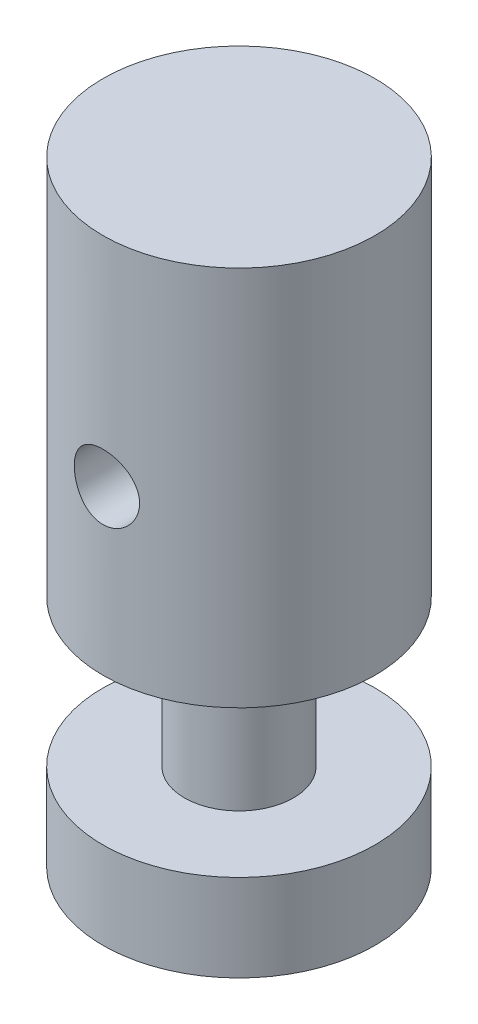
from build123d import *

# Parameters (mm, degrees)
SKETCH1_R               = 2.5
BOSS_EXTRUDE1_DEPTH     = 7
CUT_EXTRUDE1_DEPTH      = 8.842193571
CUT_EXTRUDE1_DEPTH_BACK = 8.842193571
SKETCH2_R               = 0.6
SKETCH3_R               = 1.002734692
BOSS_EXTRUDE2_DEPTH     = 4.3
SKETCH4_R               = 2.5
BOSS_EXTRUDE3_DEPTH     = 1.6


with BuildPart() as part:
    # Sketch1 → Boss-Extrude1 (new body)
    with BuildSketch(Plane(origin=(0, 0, 0), x_dir=(1, 0, 0), z_dir=(0, 1, 0))):
        with Locations(Location((0, 0, 0), (0, 0, 270))):
            Circle(SKETCH1_R)
    extrude(amount=BOSS_EXTRUDE1_DEPTH)

    # Sketch2 → Cut-Extrude1 (cut, two sides: drawn at the far end of the back side and taken through both)
    with BuildSketch(Plane.XY.offset(-CUT_EXTRUDE1_DEPTH_BACK)):
        with Locations(Location((0, 3, 0), (0, 0, 90.000000021))):
            Circle(SKETCH2_R)
    extrude(amount=CUT_EXTRUDE1_DEPTH + CUT_EXTRUDE1_DEPTH_BACK, mode=Mode.SUBTRACT)

    # Sketch3 → Boss-Extrude2 (add)
    with BuildSketch(Plane.XZ):
        with Locations(Location((0, 0, 0), (0, 0, 90))):
            Circle(SKETCH3_R)
    extrude(amount=BOSS_EXTRUDE2_DEPTH)

    # Sketch4 → Boss-Extrude3 (add)
    with BuildSketch(Plane.XZ.offset(4.3)):
        with Locations(Location((0, 0, 0), (0, 0, 90))):
            Circle(SKETCH4_R)
    extrude(amount=-BOSS_EXTRUDE3_DEPTH)


solid = part.part
